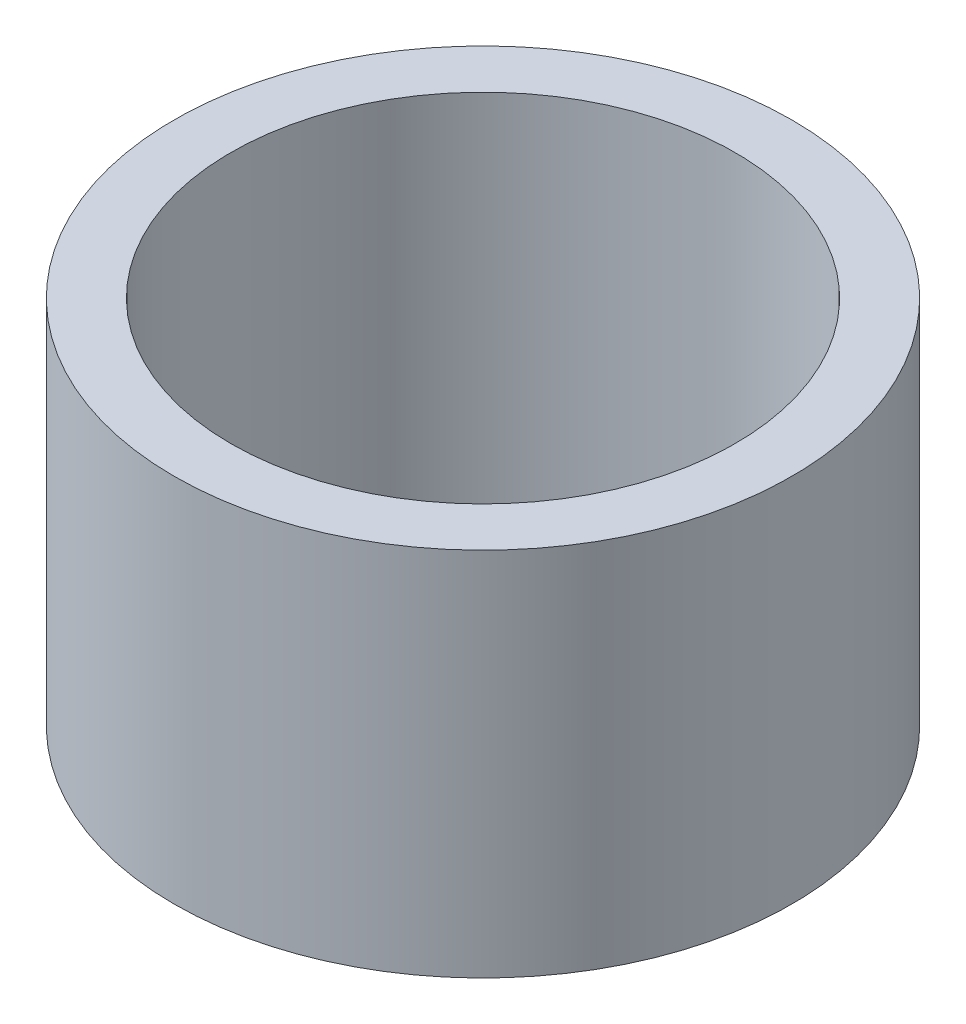
from build123d import *

# Parameters (mm, degrees)
SKETCH_1_R      = 30
SKETCH_1_R_2    = 24.5
EXTRUDE_1_DEPTH = 18


with BuildPart() as part:
    # 草图1 → 凸台-拉伸1 (new, symmetric)
    with BuildSketch(Plane(origin=(0, 0, 0), x_dir=(1, 0, 0), z_dir=(0, 1, 0))):
        with Locations(Location((0, 0, 0), (0, 0, 270))):
            Circle(SKETCH_1_R)
        with Locations(Location((0, 0, 0), (0, 0, 270))):
            Circle(SKETCH_1_R_2, mode=Mode.SUBTRACT)
    extrude(amount=EXTRUDE_1_DEPTH, both=True)


solid = part.part
